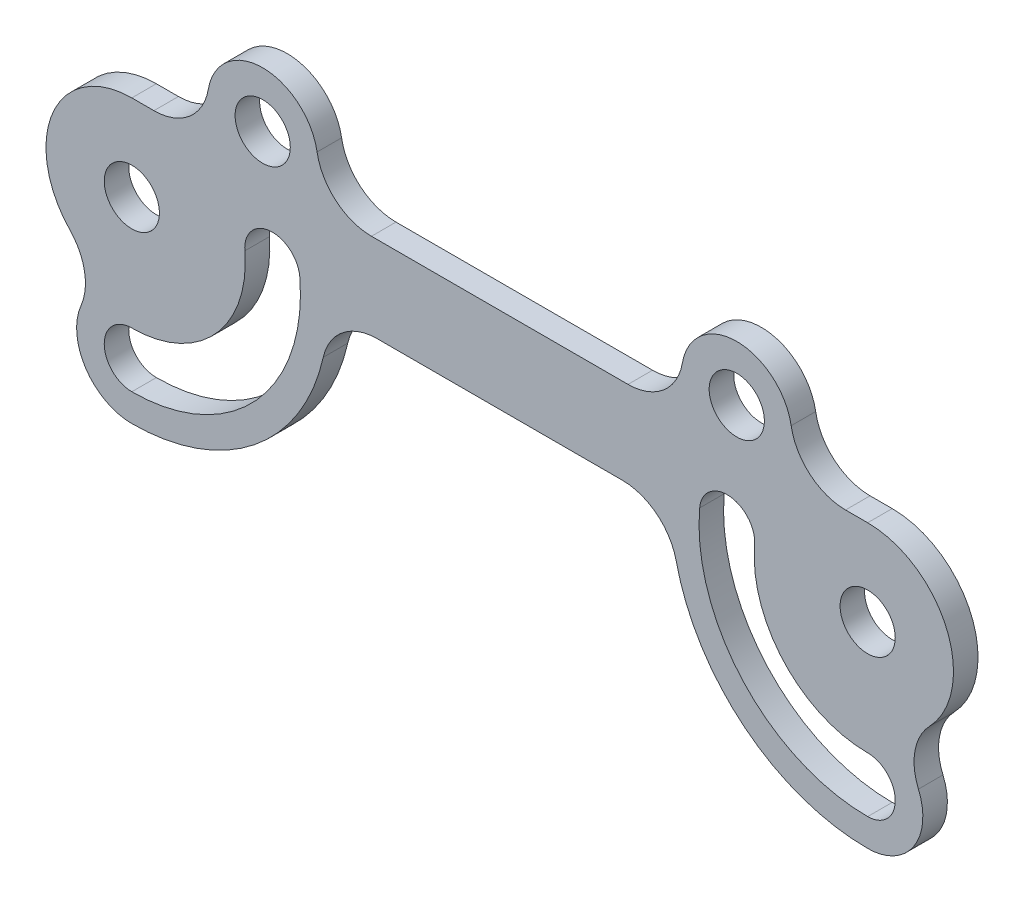
from build123d import *

# Parameters (mm, degrees)
SKETCH1_R           = 1.7859375
BOSS_EXTRUDE1_DEPTH = 1.5875
FILLET1_R           = 3.571875


with BuildPart() as part:
    # Sketch1 → Boss-Extrude1 (new body)
    with BuildSketch(Plane.XY):
        with BuildLine():
            ThreePointArc((0, 5.55625), (-5.55625, 0), (0, -5.55625))
            ThreePointArc((0, -5.55625), (-3.571875, -9.128125), (0, -12.7))
            ThreePointArc((0, -12.7), (8.980256121, -8.980256121), (12.7, 0))
            Line((12.7, 0), (34.925, 0))
            ThreePointArc((34.925, 0), (38.644743879, -8.980256121), (47.625, -12.7))
            ThreePointArc((47.625, -12.7), (51.196875, -9.128125), (47.625, -5.55625))
            ThreePointArc((47.625, -5.55625), (53.18125, 0), (47.625, 5.55625))
            Line((47.625, 5.55625), (41.839019559, 5.55625))
            ThreePointArc((41.839019559, 5.55625), (39.154229109, 11.484009389), (36.469438658, 5.55625))
            Line((36.469438658, 5.55625), (11.155561342, 5.55625))
            ThreePointArc((11.155561342, 5.55625), (8.470770891, 11.484009389), (5.785980441, 5.55625))
            Line((5.785980441, 5.55625), (0, 5.55625))
        make_face()
        Circle(SKETCH1_R, mode=Mode.SUBTRACT)
        with BuildLine():
            ThreePointArc((7.31424826, 0.639913805), (8.937735019, 2.574709983), (10.872531197, 0.951223224))
            ThreePointArc((10.872531197, 0.951223224), (8.046690934, -7.37343375), (0, -10.9140625))
            ThreePointArc((0, -10.9140625), (-1.7859375, -9.128125), (0, -7.3421875))
            ThreePointArc((0, -7.3421875), (5.413228446, -4.960309977), (7.31424826, 0.639913805))
        make_face(mode=Mode.SUBTRACT)
        with Locations((8.470770891, 7.912134389)):
            Circle(SKETCH1_R, mode=Mode.SUBTRACT)
        with BuildLine():
            ThreePointArc((40.31075174, 0.639913805), (42.211771554, -4.960309977), (47.625, -7.3421875))
            ThreePointArc((47.625, -7.3421875), (49.4109375, -9.128125), (47.625, -10.9140625))
            ThreePointArc((47.625, -10.9140625), (39.578309066, -7.37343375), (36.752468803, 0.951223224))
            ThreePointArc((36.752468803, 0.951223224), (38.687264981, 2.574709983), (40.31075174, 0.639913805))
        make_face(mode=Mode.SUBTRACT)
        with Locations((39.154229109, 7.912134389)):
            Circle(SKETCH1_R, mode=Mode.SUBTRACT)
        with Locations((47.625, 0)):
            Circle(SKETCH1_R, mode=Mode.SUBTRACT)
    extrude(amount=BOSS_EXTRUDE1_DEPTH)

    # Fillet1
    fillet1_edges = [part.edges().sort_by_distance(p)[0] for p in [
        (47.625, -5.55625, 0.79375),
        (41.839019559, 5.55625, 0.79375),
        (34.925, 0, 0.79375),
        (36.469438658, 5.55625, 0.79375),
        (12.7, 0, 0.79375),
        (0, -5.55625, 0.79375),
        (11.155561342, 5.55625, 0.79375),
        (5.785980441, 5.55625, 0.79375),
    ]]
    fillet(fillet1_edges, radius=FILLET1_R)


solid = part.part
